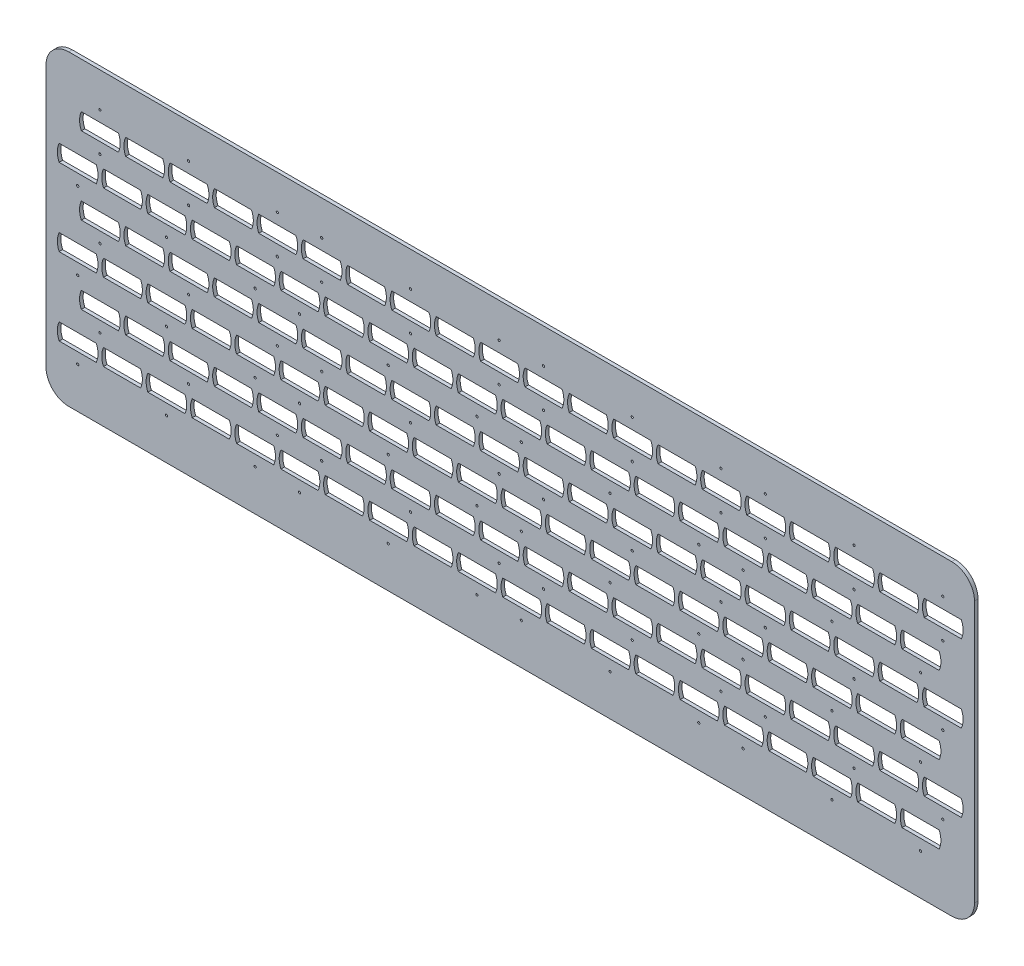
from build123d import *

# Parameters (mm, degrees)
SKETCH1_W             = 414.644000022
SKETCH1_H             = 137.13093605
SKETCH1_R             = 9.075
PLATE_THICKNESS_DEPTH = 1.5748
SKETCH2_W             = 404.484
SKETCH2_H             = 9.757695242
SKETCH2_H_2           = 9.7576953
SKETCH2_H_3           = 9.9863047
BUSBAR_WIDTH_DEPTH    = 1.5748
SKETCH3_R             = 0.5
CUT_EXTRUDE1_DEPTH    = 437.734496429
FILLET1_R             = 10.16


with BuildPart() as part:
    # Sketch1 → Plate thickness (new body)
    with BuildSketch(Plane.XY):
        with Locations((207.322000011, 68.565468025)):
            Rectangle(SKETCH1_W, SKETCH1_H)
        with Locations((14.155, 26.855)):
            Circle(SKETCH1_R, mode=Mode.SUBTRACT)
        with Locations((33.967, 26.855)):
            Circle(SKETCH1_R, mode=Mode.SUBTRACT)
        with Locations((53.779, 26.855)):
            Circle(SKETCH1_R, mode=Mode.SUBTRACT)
        with Locations((73.591, 26.855)):
            Circle(SKETCH1_R, mode=Mode.SUBTRACT)
        with Locations((93.403, 26.855)):
            Circle(SKETCH1_R, mode=Mode.SUBTRACT)
        with Locations((113.215, 26.855)):
            Circle(SKETCH1_R, mode=Mode.SUBTRACT)
        with Locations((133.027, 26.855)):
            Circle(SKETCH1_R, mode=Mode.SUBTRACT)
        with Locations((152.839, 26.855)):
            Circle(SKETCH1_R, mode=Mode.SUBTRACT)
        with Locations((172.651, 26.855)):
            Circle(SKETCH1_R, mode=Mode.SUBTRACT)
        with Locations((192.463, 26.855)):
            Circle(SKETCH1_R, mode=Mode.SUBTRACT)
        with Locations((212.275, 26.855)):
            Circle(SKETCH1_R, mode=Mode.SUBTRACT)
        with Locations((232.087, 26.855)):
            Circle(SKETCH1_R, mode=Mode.SUBTRACT)
        with Locations((251.899, 26.855)):
            Circle(SKETCH1_R, mode=Mode.SUBTRACT)
        with Locations((271.711, 26.855)):
            Circle(SKETCH1_R, mode=Mode.SUBTRACT)
        with Locations((291.523, 26.855)):
            Circle(SKETCH1_R, mode=Mode.SUBTRACT)
        with Locations((311.335, 26.855)):
            Circle(SKETCH1_R, mode=Mode.SUBTRACT)
        with Locations((331.147, 26.855)):
            Circle(SKETCH1_R, mode=Mode.SUBTRACT)
        with Locations((350.959, 26.855)):
            Circle(SKETCH1_R, mode=Mode.SUBTRACT)
        with Locations((370.771, 26.855)):
            Circle(SKETCH1_R, mode=Mode.SUBTRACT)
        with Locations((390.583, 26.855)):
            Circle(SKETCH1_R, mode=Mode.SUBTRACT)
        with Locations((43.873, 44.0126953)):
            Circle(SKETCH1_R, mode=Mode.SUBTRACT)
        with Locations((63.685, 44.0126953)):
            Circle(SKETCH1_R, mode=Mode.SUBTRACT)
        with Locations((83.497, 44.0126953)):
            Circle(SKETCH1_R, mode=Mode.SUBTRACT)
        with Locations((103.309, 44.0126953)):
            Circle(SKETCH1_R, mode=Mode.SUBTRACT)
        with Locations((123.121, 44.0126953)):
            Circle(SKETCH1_R, mode=Mode.SUBTRACT)
        with Locations((142.933, 44.0126953)):
            Circle(SKETCH1_R, mode=Mode.SUBTRACT)
        with Locations((162.745, 44.0126953)):
            Circle(SKETCH1_R, mode=Mode.SUBTRACT)
        with Locations((182.557, 44.0126953)):
            Circle(SKETCH1_R, mode=Mode.SUBTRACT)
        with Locations((202.369, 44.0126953)):
            Circle(SKETCH1_R, mode=Mode.SUBTRACT)
        with Locations((222.181, 44.0126953)):
            Circle(SKETCH1_R, mode=Mode.SUBTRACT)
        with Locations((241.993, 44.0126953)):
            Circle(SKETCH1_R, mode=Mode.SUBTRACT)
        with Locations((261.805, 44.0126953)):
            Circle(SKETCH1_R, mode=Mode.SUBTRACT)
        with Locations((281.617, 44.0126953)):
            Circle(SKETCH1_R, mode=Mode.SUBTRACT)
        with Locations((301.429, 44.0126953)):
            Circle(SKETCH1_R, mode=Mode.SUBTRACT)
        with Locations((321.241, 44.0126953)):
            Circle(SKETCH1_R, mode=Mode.SUBTRACT)
        with Locations((341.053, 44.0126953)):
            Circle(SKETCH1_R, mode=Mode.SUBTRACT)
        with Locations((360.865, 44.0126953)):
            Circle(SKETCH1_R, mode=Mode.SUBTRACT)
        with Locations((380.677, 44.0126953)):
            Circle(SKETCH1_R, mode=Mode.SUBTRACT)
        with Locations((400.489, 44.0126953)):
            Circle(SKETCH1_R, mode=Mode.SUBTRACT)
        with Locations((24.061, 44.0126953)):
            Circle(SKETCH1_R, mode=Mode.SUBTRACT)
        with Locations((14.155, 61.399)):
            Circle(SKETCH1_R, mode=Mode.SUBTRACT)
        with Locations((33.967, 61.399)):
            Circle(SKETCH1_R, mode=Mode.SUBTRACT)
        with Locations((53.779, 61.399)):
            Circle(SKETCH1_R, mode=Mode.SUBTRACT)
        with Locations((73.591, 61.399)):
            Circle(SKETCH1_R, mode=Mode.SUBTRACT)
        with Locations((93.403, 61.399)):
            Circle(SKETCH1_R, mode=Mode.SUBTRACT)
        with Locations((113.215, 61.399)):
            Circle(SKETCH1_R, mode=Mode.SUBTRACT)
        with Locations((133.027, 61.399)):
            Circle(SKETCH1_R, mode=Mode.SUBTRACT)
        with Locations((152.839, 61.399)):
            Circle(SKETCH1_R, mode=Mode.SUBTRACT)
        with Locations((172.651, 61.399)):
            Circle(SKETCH1_R, mode=Mode.SUBTRACT)
        with Locations((192.463, 61.399)):
            Circle(SKETCH1_R, mode=Mode.SUBTRACT)
        with Locations((212.275, 61.399)):
            Circle(SKETCH1_R, mode=Mode.SUBTRACT)
        with Locations((232.087, 61.399)):
            Circle(SKETCH1_R, mode=Mode.SUBTRACT)
        with Locations((251.899, 61.399)):
            Circle(SKETCH1_R, mode=Mode.SUBTRACT)
        with Locations((271.711, 61.399)):
            Circle(SKETCH1_R, mode=Mode.SUBTRACT)
        with Locations((291.523, 61.399)):
            Circle(SKETCH1_R, mode=Mode.SUBTRACT)
        with Locations((311.335, 61.399)):
            Circle(SKETCH1_R, mode=Mode.SUBTRACT)
        with Locations((331.147, 61.399)):
            Circle(SKETCH1_R, mode=Mode.SUBTRACT)
        with Locations((350.959, 61.399)):
            Circle(SKETCH1_R, mode=Mode.SUBTRACT)
        with Locations((370.771, 61.399)):
            Circle(SKETCH1_R, mode=Mode.SUBTRACT)
        with Locations((390.583, 61.399)):
            Circle(SKETCH1_R, mode=Mode.SUBTRACT)
        with Locations((43.873, 78.5566953)):
            Circle(SKETCH1_R, mode=Mode.SUBTRACT)
        with Locations((63.685, 78.5566953)):
            Circle(SKETCH1_R, mode=Mode.SUBTRACT)
        with Locations((83.497, 78.5566953)):
            Circle(SKETCH1_R, mode=Mode.SUBTRACT)
        with Locations((103.309, 78.5566953)):
            Circle(SKETCH1_R, mode=Mode.SUBTRACT)
        with Locations((123.121, 78.5566953)):
            Circle(SKETCH1_R, mode=Mode.SUBTRACT)
        with Locations((142.933, 78.5566953)):
            Circle(SKETCH1_R, mode=Mode.SUBTRACT)
        with Locations((162.745, 78.5566953)):
            Circle(SKETCH1_R, mode=Mode.SUBTRACT)
        with Locations((182.557, 78.5566953)):
            Circle(SKETCH1_R, mode=Mode.SUBTRACT)
        with Locations((202.369, 78.5566953)):
            Circle(SKETCH1_R, mode=Mode.SUBTRACT)
        with Locations((222.181, 78.5566953)):
            Circle(SKETCH1_R, mode=Mode.SUBTRACT)
        with Locations((241.993, 78.5566953)):
            Circle(SKETCH1_R, mode=Mode.SUBTRACT)
        with Locations((261.805, 78.5566953)):
            Circle(SKETCH1_R, mode=Mode.SUBTRACT)
        with Locations((281.617, 78.5566953)):
            Circle(SKETCH1_R, mode=Mode.SUBTRACT)
        with Locations((301.429, 78.5566953)):
            Circle(SKETCH1_R, mode=Mode.SUBTRACT)
        with Locations((321.241, 78.5566953)):
            Circle(SKETCH1_R, mode=Mode.SUBTRACT)
        with Locations((341.053, 78.5566953)):
            Circle(SKETCH1_R, mode=Mode.SUBTRACT)
        with Locations((360.865, 78.5566953)):
            Circle(SKETCH1_R, mode=Mode.SUBTRACT)
        with Locations((380.677, 78.5566953)):
            Circle(SKETCH1_R, mode=Mode.SUBTRACT)
        with Locations((400.489, 78.5566953)):
            Circle(SKETCH1_R, mode=Mode.SUBTRACT)
        with Locations((24.061, 78.5566953)):
            Circle(SKETCH1_R, mode=Mode.SUBTRACT)
        with Locations((14.155, 95.943)):
            Circle(SKETCH1_R, mode=Mode.SUBTRACT)
        with Locations((33.967, 95.943)):
            Circle(SKETCH1_R, mode=Mode.SUBTRACT)
        with Locations((53.779, 95.943)):
            Circle(SKETCH1_R, mode=Mode.SUBTRACT)
        with Locations((73.591, 95.943)):
            Circle(SKETCH1_R, mode=Mode.SUBTRACT)
        with Locations((93.403, 95.943)):
            Circle(SKETCH1_R, mode=Mode.SUBTRACT)
        with Locations((113.215, 95.943)):
            Circle(SKETCH1_R, mode=Mode.SUBTRACT)
        with Locations((133.027, 95.943)):
            Circle(SKETCH1_R, mode=Mode.SUBTRACT)
        with Locations((152.839, 95.943)):
            Circle(SKETCH1_R, mode=Mode.SUBTRACT)
        with Locations((172.651, 95.943)):
            Circle(SKETCH1_R, mode=Mode.SUBTRACT)
        with Locations((192.463, 95.943)):
            Circle(SKETCH1_R, mode=Mode.SUBTRACT)
        with Locations((212.275, 95.943)):
            Circle(SKETCH1_R, mode=Mode.SUBTRACT)
        with Locations((232.087, 95.943)):
            Circle(SKETCH1_R, mode=Mode.SUBTRACT)
        with Locations((251.899, 95.943)):
            Circle(SKETCH1_R, mode=Mode.SUBTRACT)
        with Locations((271.711, 95.943)):
            Circle(SKETCH1_R, mode=Mode.SUBTRACT)
        with Locations((291.523, 95.943)):
            Circle(SKETCH1_R, mode=Mode.SUBTRACT)
        with Locations((311.335, 95.943)):
            Circle(SKETCH1_R, mode=Mode.SUBTRACT)
        with Locations((331.147, 95.943)):
            Circle(SKETCH1_R, mode=Mode.SUBTRACT)
        with Locations((350.959, 95.943)):
            Circle(SKETCH1_R, mode=Mode.SUBTRACT)
        with Locations((370.771, 95.943)):
            Circle(SKETCH1_R, mode=Mode.SUBTRACT)
        with Locations((390.583, 95.943)):
            Circle(SKETCH1_R, mode=Mode.SUBTRACT)
        with Locations((43.873, 113.1006953)):
            Circle(SKETCH1_R, mode=Mode.SUBTRACT)
        with Locations((63.685, 113.1006953)):
            Circle(SKETCH1_R, mode=Mode.SUBTRACT)
        with Locations((83.497, 113.1006953)):
            Circle(SKETCH1_R, mode=Mode.SUBTRACT)
        with Locations((103.309, 113.1006953)):
            Circle(SKETCH1_R, mode=Mode.SUBTRACT)
        with Locations((123.121, 113.1006953)):
            Circle(SKETCH1_R, mode=Mode.SUBTRACT)
        with Locations((142.933, 113.1006953)):
            Circle(SKETCH1_R, mode=Mode.SUBTRACT)
        with Locations((162.745, 113.1006953)):
            Circle(SKETCH1_R, mode=Mode.SUBTRACT)
        with Locations((182.557, 113.1006953)):
            Circle(SKETCH1_R, mode=Mode.SUBTRACT)
        with Locations((202.369, 113.1006953)):
            Circle(SKETCH1_R, mode=Mode.SUBTRACT)
        with Locations((222.181, 113.1006953)):
            Circle(SKETCH1_R, mode=Mode.SUBTRACT)
        with Locations((241.993, 113.1006953)):
            Circle(SKETCH1_R, mode=Mode.SUBTRACT)
        with Locations((261.805, 113.1006953)):
            Circle(SKETCH1_R, mode=Mode.SUBTRACT)
        with Locations((281.617, 113.1006953)):
            Circle(SKETCH1_R, mode=Mode.SUBTRACT)
        with Locations((301.429, 113.1006953)):
            Circle(SKETCH1_R, mode=Mode.SUBTRACT)
        with Locations((321.241, 113.1006953)):
            Circle(SKETCH1_R, mode=Mode.SUBTRACT)
        with Locations((341.053, 113.1006953)):
            Circle(SKETCH1_R, mode=Mode.SUBTRACT)
        with Locations((360.865, 113.1006953)):
            Circle(SKETCH1_R, mode=Mode.SUBTRACT)
        with Locations((380.677, 113.1006953)):
            Circle(SKETCH1_R, mode=Mode.SUBTRACT)
        with Locations((400.489, 113.1006953)):
            Circle(SKETCH1_R, mode=Mode.SUBTRACT)
        with Locations((24.061, 113.1006953)):
            Circle(SKETCH1_R, mode=Mode.SUBTRACT)
    extrude(amount=PLATE_THICKNESS_DEPTH)

    # Sketch2 → Busbar Width (add, through all)
    with BuildSketch(Plane.XY.offset(1.5748)):
        with Locations((207.322, 18.276152379)):
            Rectangle(SKETCH2_W, SKETCH2_H)
        with Locations((207.322, 35.43384765)):
            Rectangle(SKETCH2_W, SKETCH2_H_2)
        with Locations((207.322, 52.70584765)):
            Rectangle(SKETCH2_W, SKETCH2_H_3)
        with Locations((207.322, 69.97784765)):
            Rectangle(SKETCH2_W, SKETCH2_H_2)
        with Locations((207.322, 87.24984765)):
            Rectangle(SKETCH2_W, SKETCH2_H_3)
        with Locations((207.322, 104.52184765)):
            Rectangle(SKETCH2_W, SKETCH2_H_2)
        with Locations((207.322, 121.679542921)):
            Rectangle(SKETCH2_W, SKETCH2_H)
    extrude(amount=-BUSBAR_WIDTH_DEPTH)

    # Sketch3 → Cut-Extrude1 (cut, through all)
    with BuildSketch(Plane.XY.offset(1.5748)):
        with Locations((14.155, 18.276152379)):
            Circle(SKETCH3_R)
        with Locations((53.779, 18.276152379)):
            Circle(SKETCH3_R)
        with Locations((93.403, 18.276152379)):
            Circle(SKETCH3_R)
        with Locations((24.061, 35.43384765)):
            Circle(SKETCH3_R)
        with Locations((63.685, 35.43384765)):
            Circle(SKETCH3_R)
        with Locations((103.309, 35.43384765)):
            Circle(SKETCH3_R)
        with Locations((113.215, 18.276152379)):
            Circle(SKETCH3_R)
        with Locations((152.839, 18.276152379)):
            Circle(SKETCH3_R)
        with Locations((192.463, 18.276152379)):
            Circle(SKETCH3_R)
        with Locations((202.369, 35.43384765)):
            Circle(SKETCH3_R)
        with Locations((162.745, 35.43384765)):
            Circle(SKETCH3_R)
        with Locations((123.121, 35.43384765)):
            Circle(SKETCH3_R)
        with Locations((212.275, 18.276152379)):
            Circle(SKETCH3_R)
        with Locations((251.899, 18.276152379)):
            Circle(SKETCH3_R)
        with Locations((291.523, 18.276152379)):
            Circle(SKETCH3_R)
        with Locations((301.429, 35.43384765)):
            Circle(SKETCH3_R)
        with Locations((261.805, 35.43384765)):
            Circle(SKETCH3_R)
        with Locations((222.181, 35.43384765)):
            Circle(SKETCH3_R)
        with Locations((311.335, 18.276152379)):
            Circle(SKETCH3_R)
        with Locations((350.959, 18.276152379)):
            Circle(SKETCH3_R)
        with Locations((390.583, 18.276152379)):
            Circle(SKETCH3_R)
        with Locations((400.489, 35.43384765)):
            Circle(SKETCH3_R)
        with Locations((360.865, 35.43384765)):
            Circle(SKETCH3_R)
        with Locations((321.241, 35.43384765)):
            Circle(SKETCH3_R)
        with Locations((14.155, 52.70584765)):
            Circle(SKETCH3_R)
        with Locations((53.779, 52.70584765)):
            Circle(SKETCH3_R)
        with Locations((93.403, 52.70584765)):
            Circle(SKETCH3_R)
        with Locations((24.061, 69.97784765)):
            Circle(SKETCH3_R)
        with Locations((63.685, 69.97784765)):
            Circle(SKETCH3_R)
        with Locations((103.309, 69.97784765)):
            Circle(SKETCH3_R)
        with Locations((14.155, 87.24984765)):
            Circle(SKETCH3_R)
        with Locations((53.779, 87.24984765)):
            Circle(SKETCH3_R)
        with Locations((93.403, 87.24984765)):
            Circle(SKETCH3_R)
        with Locations((24.061, 104.52184765)):
            Circle(SKETCH3_R)
        with Locations((63.685, 104.52184765)):
            Circle(SKETCH3_R)
        with Locations((103.309, 104.52184765)):
            Circle(SKETCH3_R)
        with Locations((24.061, 121.679542921)):
            Circle(SKETCH3_R)
        with Locations((63.685, 121.679542921)):
            Circle(SKETCH3_R)
        with Locations((103.309, 121.679542921)):
            Circle(SKETCH3_R)
        with Locations((113.215, 52.70584765)):
            Circle(SKETCH3_R)
        with Locations((152.839, 52.70584765)):
            Circle(SKETCH3_R)
        with Locations((192.463, 52.70584765)):
            Circle(SKETCH3_R)
        with Locations((202.369, 69.97784765)):
            Circle(SKETCH3_R)
        with Locations((162.745, 69.97784765)):
            Circle(SKETCH3_R)
        with Locations((123.121, 69.97784765)):
            Circle(SKETCH3_R)
        with Locations((113.215, 87.24984765)):
            Circle(SKETCH3_R)
        with Locations((192.463, 87.24984765)):
            Circle(SKETCH3_R)
        with Locations((152.839, 87.24984765)):
            Circle(SKETCH3_R)
        with Locations((123.121, 104.52184765)):
            Circle(SKETCH3_R)
        with Locations((123.121, 121.679542921)):
            Circle(SKETCH3_R)
        with Locations((162.745, 121.679542921)):
            Circle(SKETCH3_R)
        with Locations((162.745, 104.52184765)):
            Circle(SKETCH3_R)
        with Locations((202.369, 104.52184765)):
            Circle(SKETCH3_R)
        with Locations((202.369, 121.679542921)):
            Circle(SKETCH3_R)
        with Locations((212.275, 52.70584765)):
            Circle(SKETCH3_R)
        with Locations((251.899, 52.70584765)):
            Circle(SKETCH3_R)
        with Locations((291.523, 52.70584765)):
            Circle(SKETCH3_R)
        with Locations((301.429, 69.97784765)):
            Circle(SKETCH3_R)
        with Locations((261.805, 69.97784765)):
            Circle(SKETCH3_R)
        with Locations((222.181, 69.97784765)):
            Circle(SKETCH3_R)
        with Locations((212.275, 87.24984765)):
            Circle(SKETCH3_R)
        with Locations((291.523, 87.24984765)):
            Circle(SKETCH3_R)
        with Locations((251.899, 87.24984765)):
            Circle(SKETCH3_R)
        with Locations((222.181, 104.52184765)):
            Circle(SKETCH3_R)
        with Locations((222.181, 121.679542921)):
            Circle(SKETCH3_R)
        with Locations((261.805, 121.679542921)):
            Circle(SKETCH3_R)
        with Locations((261.805, 104.52184765)):
            Circle(SKETCH3_R)
        with Locations((301.429, 104.52184765)):
            Circle(SKETCH3_R)
        with Locations((301.429, 121.679542921)):
            Circle(SKETCH3_R)
        with Locations((311.335, 52.70584765)):
            Circle(SKETCH3_R)
        with Locations((350.959, 52.70584765)):
            Circle(SKETCH3_R)
        with Locations((390.583, 52.70584765)):
            Circle(SKETCH3_R)
        with Locations((400.489, 69.97784765)):
            Circle(SKETCH3_R)
        with Locations((360.865, 69.97784765)):
            Circle(SKETCH3_R)
        with Locations((321.241, 69.97784765)):
            Circle(SKETCH3_R)
        with Locations((311.335, 87.24984765)):
            Circle(SKETCH3_R)
        with Locations((390.583, 87.24984765)):
            Circle(SKETCH3_R)
        with Locations((350.959, 87.24984765)):
            Circle(SKETCH3_R)
        with Locations((321.241, 104.52184765)):
            Circle(SKETCH3_R)
        with Locations((321.241, 121.679542921)):
            Circle(SKETCH3_R)
        with Locations((360.865, 121.679542921)):
            Circle(SKETCH3_R)
        with Locations((360.865, 104.52184765)):
            Circle(SKETCH3_R)
        with Locations((400.489, 104.52184765)):
            Circle(SKETCH3_R)
        with Locations((400.489, 121.679542921)):
            Circle(SKETCH3_R)
    extrude(amount=-CUT_EXTRUDE1_DEPTH, mode=Mode.SUBTRACT)

    # Fillet1
    fillet1_edges = [part.edges().sort_by_distance(p)[0] for p in [
        (0, 137.13093605, 0.7874),
        (414.644000022, 137.13093605, 0.7874),
        (414.644000022, 0, 0.7874),
        (0, 0, 0.7874),
    ]]
    fillet(fillet1_edges, radius=FILLET1_R)


solid = part.part
